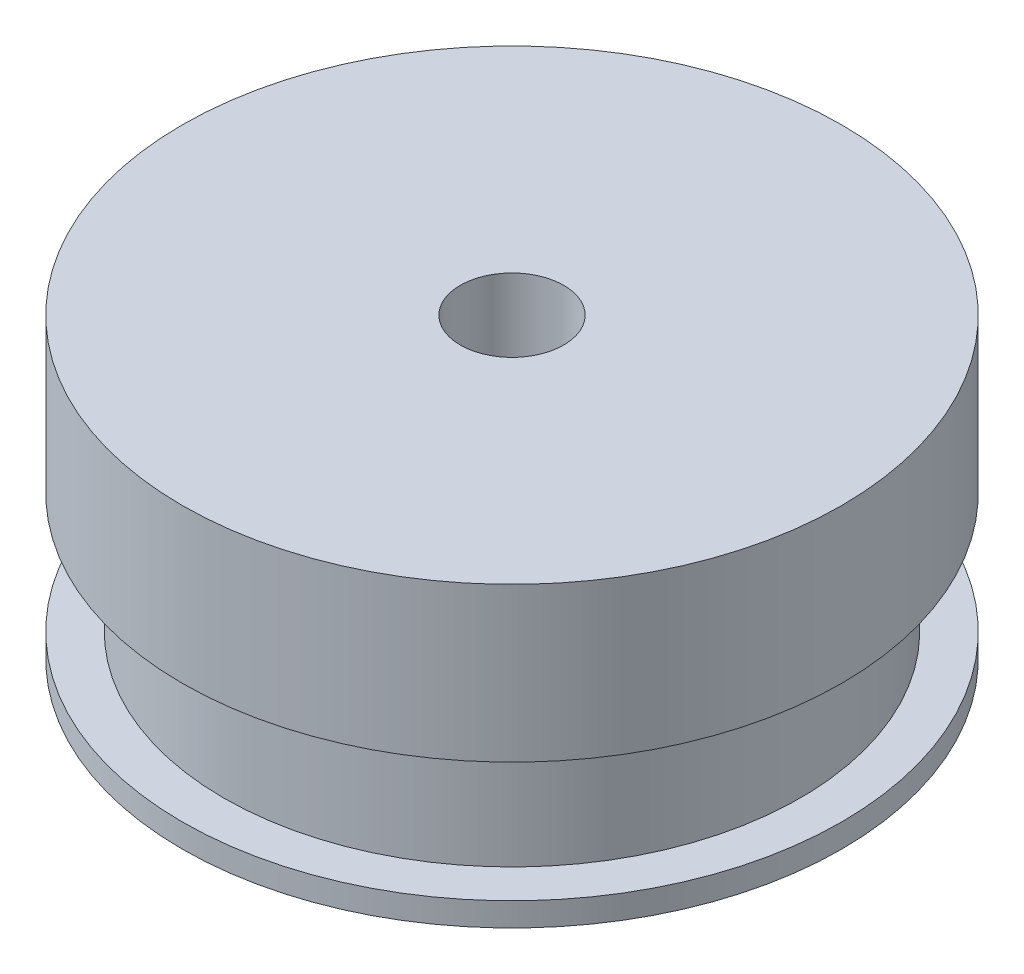
from build123d import *

# Parameters (mm, degrees)
SKETCH1_R           = 20.2311
SKETCH1_R_2         = 3.175
BOSS_EXTRUDE1_DEPTH = 18.2626
SKETCH2_W           = 2.54
SKETCH2_H           = 7.366


with BuildPart() as part:
    # Sketch1 → Boss-Extrude1 (new body)
    with BuildSketch(Plane(origin=(0, 0, 0), x_dir=(1, 0, 0), z_dir=(0, 1, 0))):
        with Locations(Location((0, 0, 0), (0, 0, 270))):
            Circle(SKETCH1_R)
        with Locations(Location((0, 0, 0), (0, 0, 270))):
            Circle(SKETCH1_R_2, mode=Mode.SUBTRACT)
    extrude(amount=BOSS_EXTRUDE1_DEPTH)

    # Sketch2 → Cut-Revolve1 (revolve, cut)
    with BuildSketch(Plane(origin=(0, 0, 0), x_dir=(0, 0, -1), z_dir=(1, 0, 0)), mode=Mode.PRIVATE) as cut_revolve1_sk:
        with Locations((18.9611, 5.1308)):
            Rectangle(SKETCH2_W, SKETCH2_H)
    revolve(cut_revolve1_sk.sketch.rotate(Axis((0, 18.2626, 0), (0, -1, 0)), 180), axis=Axis((0, 18.2626, 0), (0, -1, 0)), mode=Mode.SUBTRACT)


solid = part.part
